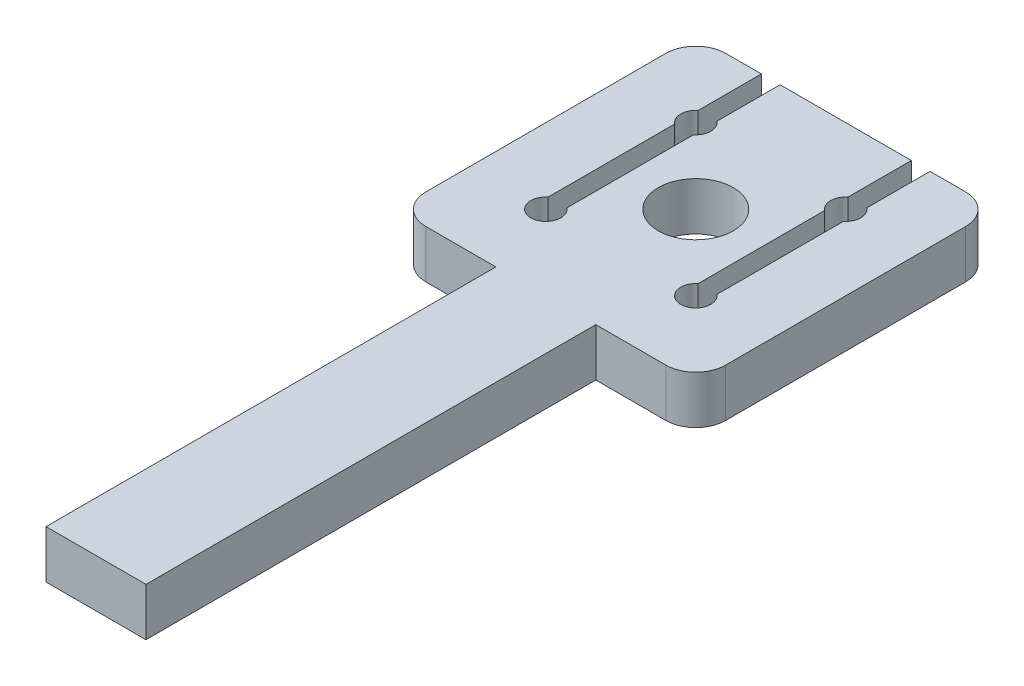
from build123d import *

# Parameters (mm, degrees)
BASE_SKETCH_R       = 2.5
BOSS_EXTRUDE1_DEPTH = 3.2
FILLET1_R           = 2


with BuildPart() as part:
    # Base_Sketch → Boss-Extrude1 (new body)
    with BuildSketch(Plane(origin=(0, 0, 0), x_dir=(1, 0, 0), z_dir=(0, 1, 0))):
        with BuildLine():
            Line((-5.625, 10), (-10, 10))
            Line((-10, 10), (-10, -10))
            Line((-10, -10), (-3.333333333, -10))
            Line((-3.333333333, -10), (-3.333333333, -40))
            Line((-3.333333333, -40), (3.333333333, -40))
            Line((3.333333333, -40), (3.333333333, -10))
            Line((3.333333333, -10), (10, -10))
            Line((10, -10), (10, 10))
            Line((10, 10), (5.625, 10))
            Line((5.625, 10), (5.625, 5.78062475))
            ThreePointArc((5.625, 5.78062475), (5.901387819, 5.433012702), (6, 5))
            ThreePointArc((6, 5), (5.901387819, 4.566987298), (5.625, 4.21937525))
            Line((5.625, 4.21937525), (5.625, -4.21937525))
            ThreePointArc((5.625, -4.21937525), (5.901387819, -4.566987298), (6, -5))
            ThreePointArc((6, -5), (4.566987298, -5.901387819), (4.375, -4.21937525))
            Line((4.375, -4.21937525), (4.375, 4.21937525))
            ThreePointArc((4.375, 4.21937525), (4, 5), (4.375, 5.78062475))
            Line((4.375, 5.78062475), (4.375, 10))
            Line((4.375, 10), (-4.375, 10))
            Line((-4.375, 10), (-4.375, 5.78062475))
            ThreePointArc((-4.375, 5.78062475), (-4.098612181, 5.433012702), (-4, 5))
            ThreePointArc((-4, 5), (-4.098612181, 4.566987298), (-4.375, 4.21937525))
            Line((-4.375, 4.21937525), (-4.375, -4.21937525))
            ThreePointArc((-4.375, -4.21937525), (-4.098612181, -4.566987298), (-4, -5))
            ThreePointArc((-4, -5), (-5.433012702, -5.901387819), (-5.625, -4.21937525))
            Line((-5.625, -4.21937525), (-5.625, 4.21937525))
            ThreePointArc((-5.625, 4.21937525), (-6, 5), (-5.625, 5.78062475))
            Line((-5.625, 5.78062475), (-5.625, 10))
        make_face()
        with Locations(Location((0, 0, 0), (0, 0, 270))):
            Circle(BASE_SKETCH_R, mode=Mode.SUBTRACT)
    extrude(amount=BOSS_EXTRUDE1_DEPTH)

    # Fillet1
    fillet1_edges = [part.edges().sort_by_distance(p)[0] for p in [
        (10, 1.6, -10),
        (10, 1.6, 10),
        (-10, 1.6, 10),
        (-10, 1.6, -10),
    ]]
    fillet(fillet1_edges, radius=FILLET1_R)


solid = part.part
